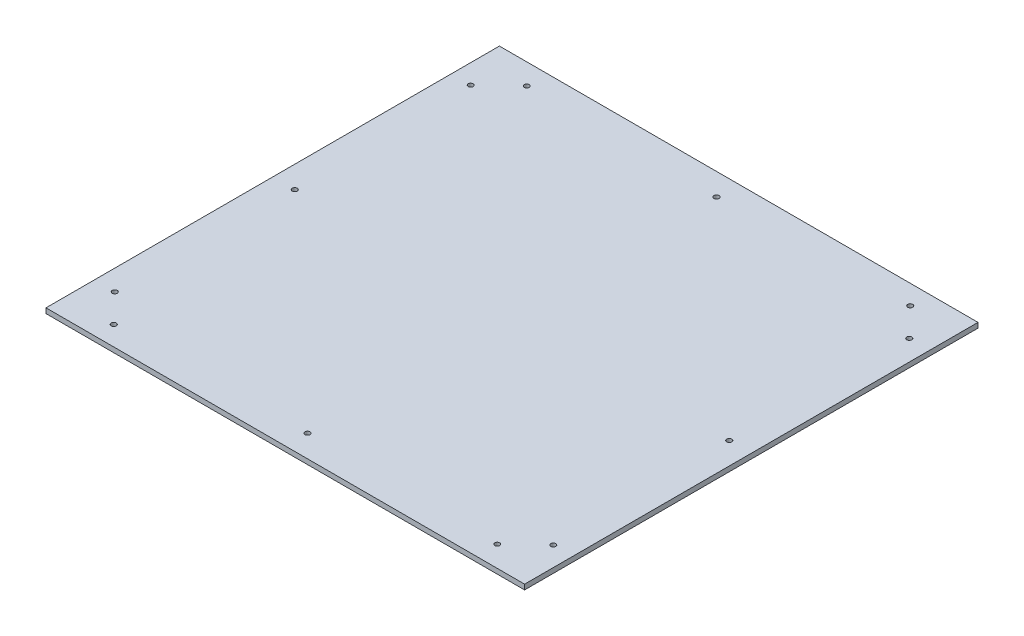
from build123d import *

# Parameters (mm, degrees)
SKETCH1_W           = 482.6
SKETCH1_H           = 457.2
BOSS_EXTRUDE1_DEPTH = 5.08
SKETCH2_R           = 2.4765
SKETCH2_R_2         = 2.54
CUT_EXTRUDE1_DEPTH  = 333.429626237


with BuildPart() as part:
    # Sketch1 → Boss-Extrude1 (new body)
    with BuildSketch(Plane(origin=(0, 0, 0), x_dir=(1, 0, 0), z_dir=(0, 1, 0))):
        Rectangle(SKETCH1_W, SKETCH1_H)
    extrude(amount=BOSS_EXTRUDE1_DEPTH)

    # Sketch2 → Cut-Extrude1 (cut, through all)
    with BuildSketch(Plane(origin=(0, 5.08, 0), x_dir=(1, 0, 0), z_dir=(0, 1, 0))):
        with Locations(Location((-192.659, 207.53832, 0), (0, 0, 270))):
            Circle(SKETCH2_R)
        with Locations(Location((192.659, -207.53832, 0), (0, 0, 270))):
            Circle(SKETCH2_R)
        with Locations(Location((-221.615, 179.959, 0), (0, 0, 270))):
            Circle(SKETCH2_R)
        with Locations(Location((221.615, -179.959, 0), (0, 0, 270))):
            Circle(SKETCH2_R)
        with Locations(Location((220.6244, 179.959, 0), (0, 0, 270))):
            Circle(SKETCH2_R_2)
        with Locations(Location((192.659, 208.915, 0), (0, 0, 270))):
            Circle(SKETCH2_R_2)
        with Locations(Location((-192.659, -208.915, 0), (0, 0, 270))):
            Circle(SKETCH2_R_2)
        with Locations(Location((-220.6244, -179.959, 0), (0, 0, 270))):
            Circle(SKETCH2_R_2)
        with Locations(Location((-219.075, 0, 0), (0, 0, 270))):
            Circle(SKETCH2_R_2)
        with Locations(Location((219.075, 0, 0), (0, 0, 270))):
            Circle(SKETCH2_R_2)
        with Locations(Location((0, -206.248, 0), (0, 0, 270))):
            Circle(SKETCH2_R_2)
        with Locations(Location((0, 206.248, 0), (0, 0, 270))):
            Circle(SKETCH2_R_2)
    extrude(amount=-CUT_EXTRUDE1_DEPTH, mode=Mode.SUBTRACT)


solid = part.part
